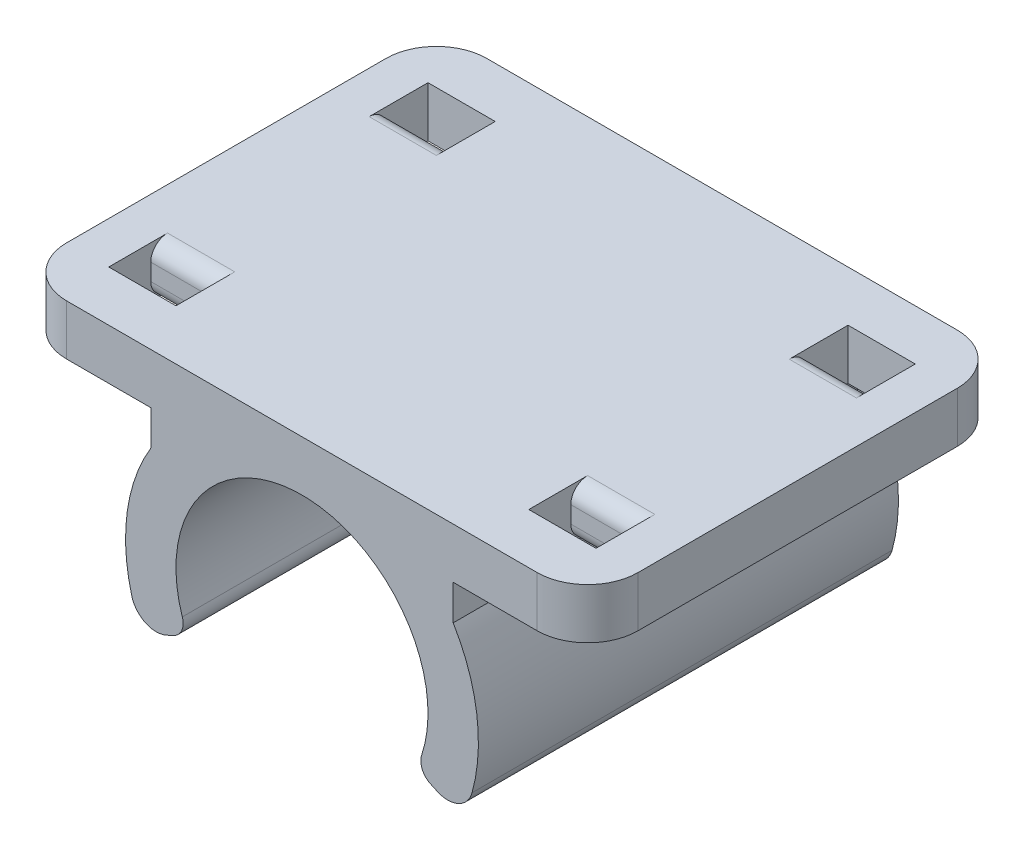
from build123d import *

# Parameters (mm, degrees)
RESSALTO_EXTRUS_O1_DEPTH = 25
FILETE1_R                = 1.5
CORTE_EXTRUS_O1_REACH    = 35.483
ESBO_O3_W                = 4
ESBO_O3_H                = 2.5
FILETE2_R                = 1
FILETE3_R                = 3


with BuildPart() as part:
    # Esboço1 → Ressalto-extrusão1 (new body)
    with BuildSketch(Plane.XY):
        with BuildLine():
            Line((-17, 10.5), (17, 10.5))
            Line((17, 10.5), (17, 7.5))
            Line((17, 7.5), (9, 7.5))
            Line((9, 7.5), (9, 5.408326913))
            ThreePointArc((9, 5.408326913), (10.485597072, 0.549776353), (9.516231764, -4.437491748))
            Line((9.516231764, -4.437491748), (7.650118208, -3.567308706))
            ThreePointArc((7.650118208, -3.567308706), (7.15483055, -3.057799008), (7.123002767, -2.347941987))
            ThreePointArc((7.123002767, -2.347941987), (0, 7.5), (-7.123002767, -2.347941987))
            ThreePointArc((-7.123002767, -2.347941987), (-7.15483055, -3.057799008), (-7.650118208, -3.567308706))
            Line((-7.650118208, -3.567308706), (-9.516231764, -4.437491748))
            ThreePointArc((-9.516231764, -4.437491748), (-10.485597072, 0.549776353), (-9, 5.408326913))
            Line((-9, 5.408326913), (-9, 7.5))
            Line((-9, 7.5), (-17, 7.5))
            Line((-17, 7.5), (-17, 10.5))
        make_face()
    extrude(amount=RESSALTO_EXTRUS_O1_DEPTH)

    # Filete1
    filete1_edges = [part.edges().sort_by_distance(p)[0] for p in [
        (-9.516231764, -4.437491748, 12.5),
        (9.516231764, -4.437491748, 12.5),
    ]]
    fillet(filete1_edges, radius=FILETE1_R)

    # Esboço3 → Corte-extrusão1 (cut, up to next)
    with BuildSketch(Plane(origin=(0, 10.5, 0), x_dir=(1, 0, 0), z_dir=(0, 1, 0)), mode=Mode.PRIVATE) as corte_extrus_o1_sk1:
        with Locations((-12.5, -4.25)):
            Rectangle(ESBO_O3_W, ESBO_O3_H)
    corte_extrus_o1_tool1 = extrude(corte_extrus_o1_sk1.sketch, amount=-CORTE_EXTRUS_O1_REACH, mode=Mode.PRIVATE) & part.part
    # Esboço3 → Corte-extrusão1 (cut, up to next)
    with BuildSketch(Plane(origin=(0, 10.5, 0), x_dir=(1, 0, 0), z_dir=(0, 1, 0)), mode=Mode.PRIVATE) as corte_extrus_o1_sk2:
        with Locations((-12.5, -20.75)):
            Rectangle(ESBO_O3_W, ESBO_O3_H)
    corte_extrus_o1_tool2 = extrude(corte_extrus_o1_sk2.sketch, amount=-CORTE_EXTRUS_O1_REACH, mode=Mode.PRIVATE) & part.part
    # Esboço3 → Corte-extrusão1 (cut, up to next)
    with BuildSketch(Plane(origin=(0, 10.5, 0), x_dir=(1, 0, 0), z_dir=(0, 1, 0)), mode=Mode.PRIVATE) as corte_extrus_o1_sk3:
        with Locations((12.5, -20.75)):
            Rectangle(ESBO_O3_W, ESBO_O3_H)
    corte_extrus_o1_tool3 = extrude(corte_extrus_o1_sk3.sketch, amount=-CORTE_EXTRUS_O1_REACH, mode=Mode.PRIVATE) & part.part
    # Esboço3 → Corte-extrusão1 (cut, up to next)
    with BuildSketch(Plane(origin=(0, 10.5, 0), x_dir=(1, 0, 0), z_dir=(0, 1, 0)), mode=Mode.PRIVATE) as corte_extrus_o1_sk4:
        with Locations((12.5, -4.25)):
            Rectangle(ESBO_O3_W, ESBO_O3_H)
    corte_extrus_o1_tool4 = extrude(corte_extrus_o1_sk4.sketch, amount=-CORTE_EXTRUS_O1_REACH, mode=Mode.PRIVATE) & part.part
    add(corte_extrus_o1_tool1.solids().sort_by_distance((-12.5, 10.5, 4.25))[0], mode=Mode.SUBTRACT)
    add(corte_extrus_o1_tool2.solids().sort_by_distance((-12.5, 10.5, 20.75))[0], mode=Mode.SUBTRACT)
    add(corte_extrus_o1_tool3.solids().sort_by_distance((12.5, 10.5, 20.75))[0], mode=Mode.SUBTRACT)
    add(corte_extrus_o1_tool4.solids().sort_by_distance((12.5, 10.5, 4.25))[0], mode=Mode.SUBTRACT)

    # Filete2
    filete2_edges = [part.edges().sort_by_distance(p)[0] for p in [
        (12.5, 10.5, 5.5),
        (12.5, 7.5, 5.5),
        (12.5, 10.5, 19.5),
        (12.5, 7.5, 19.5),
        (-12.5, 10.5, 19.5),
        (-12.5, 7.5, 19.5),
        (-12.5, 10.5, 5.5),
        (-12.5, 7.5, 5.5),
    ]]
    fillet(filete2_edges, radius=FILETE2_R)

    # Filete3
    filete3_edges = [part.edges().sort_by_distance(p)[0] for p in [
        (-17, 9, 0),
        (17, 9, 0),
        (17, 9, 25),
        (-17, 9, 25),
    ]]
    fillet(filete3_edges, radius=FILETE3_R)


solid = part.part
